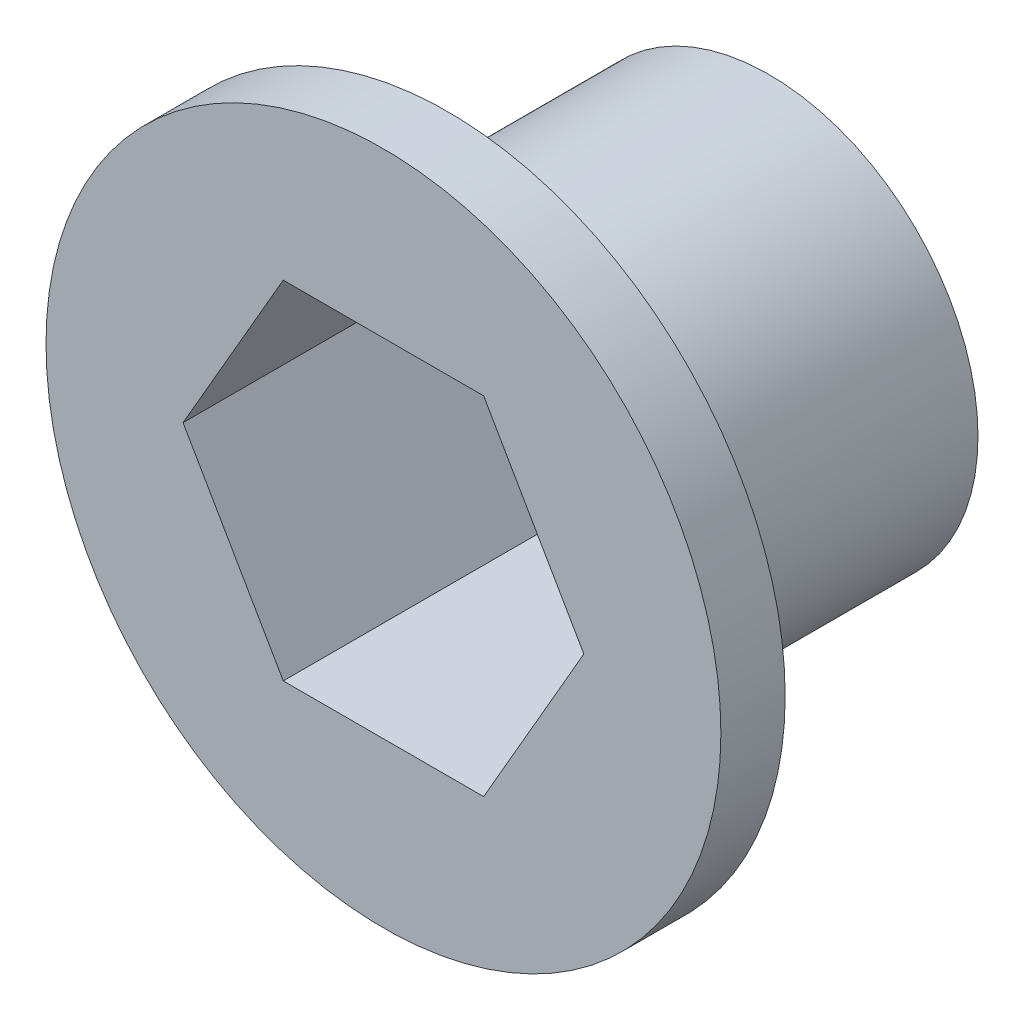
from build123d import *

# Parameters (mm, degrees)
SKETCH1_R           = 3.25
BOSS_EXTRUDE1_DEPTH = 2.5
SKETCH2_R           = 5.25
BOSS_EXTRUDE2_DEPTH = 1


with BuildPart() as part:
    # Sketch1 → Boss-Extrude1 (new, symmetric)
    with BuildSketch(Plane.XY):
        Circle(SKETCH1_R)
        Polygon((3.117691454, 0), (1.558845727, 2.7), (-1.558845727, 2.7), (-3.117691454, 0), (-1.558845727, -2.7), (1.558845727, -2.7), align=None, mode=Mode.SUBTRACT)
    extrude(amount=BOSS_EXTRUDE1_DEPTH, both=True)

    # Sketch2 → Boss-Extrude2 (add)
    with BuildSketch(Plane.XY.offset(2.5)):
        Circle(SKETCH2_R)
        Polygon((3.117691454, 0), (1.558845727, 2.7), (-1.558845727, 2.7), (-3.117691454, 0), (-1.558845727, -2.7), (1.558845727, -2.7), align=None, mode=Mode.SUBTRACT)
    extrude(amount=BOSS_EXTRUDE2_DEPTH)


solid = part.part
